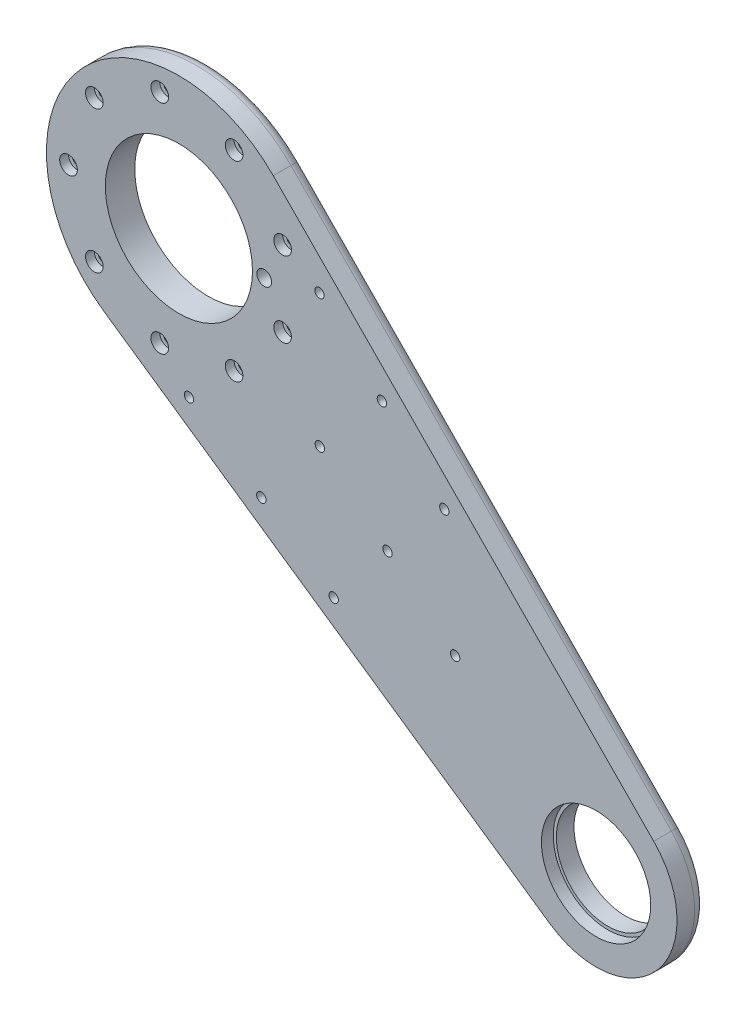
from build123d import *

# Parameters (mm, degrees)
SKETCH1_R           = 17.5
SKETCH1_R_2         = 1.6
BOSS_EXTRUDE1_DEPTH = 10
SKETCH2_R           = 25
SKETCH2_R_2         = 2.5
SKETCH2_R_3         = 1.6
CUT_EXTRUDE1_DEPTH  = 224.991888552
SKETCH3_R           = 18.5625
CUT_EXTRUDE2_DEPTH  = 4
SKETCH4_R           = 3
CUT_EXTRUDE3_DEPTH  = 3
FILLET1_R           = 4


with BuildPart() as part:
    # Sketch1 → Boss-Extrude1 (new body)
    with BuildSketch(Plane.XY):
        with BuildLine():
            Line((-25.534872354, -37.053613776), (126.113577761, -141.559582877))
            ThreePointArc((126.113577761, -141.559582877), (162.784444163, -136.592367058), (161.308367688, -99.616065541))
            Line((161.308367688, -99.616065541), (32.056602073, 31.581232775))
            ThreePointArc((32.056602073, 31.581232775), (-34.47199994, 28.925442436), (-25.534872354, -37.053613776))
        make_face()
        with Locations((141.718221977, -118.915707792)):
            Circle(SKETCH1_R, mode=Mode.SUBTRACT)
        with Locations((70.859110989, -59.457853896)):
            Circle(SKETCH1_R_2, mode=Mode.SUBTRACT)
        with Locations((93.840444282, -78.741482187)):
            Circle(SKETCH1_R_2, mode=Mode.SUBTRACT)
        with Locations((47.877777695, -40.174225605)):
            Circle(SKETCH1_R_2, mode=Mode.SUBTRACT)
        with Locations((47.767990244, 4.946625931)):
            Circle(SKETCH1_R_2, mode=Mode.SUBTRACT)
        with Locations((3.423348889, -47.901259716)):
            Circle(SKETCH1_R_2, mode=Mode.SUBTRACT)
        with Locations((68.973861607, -16.273907044)):
            Circle(SKETCH1_R_2, mode=Mode.SUBTRACT)
        with Locations((90.17973297, -37.494440018)):
            Circle(SKETCH1_R_2, mode=Mode.SUBTRACT)
        with Locations((28.003855203, -65.100059364)):
            Circle(SKETCH1_R_2, mode=Mode.SUBTRACT)
        with Locations((52.584361518, -82.298859012)):
            Circle(SKETCH1_R_2, mode=Mode.SUBTRACT)
    extrude(amount=BOSS_EXTRUDE1_DEPTH)

    # Sketch2 → Cut-Extrude1 (cut, through all)
    with BuildSketch(Plane.XY.offset(10)):
        Circle(SKETCH2_R)
        with Locations((29, 0)):
            Circle(SKETCH2_R_2)
        with Locations((-37.5, 0)):
            Circle(SKETCH2_R_3)
        with Locations((-28.726666617, 24.104535363)):
            Circle(SKETCH2_R_3)
        with Locations((-6.511806663, 36.930290738)):
            Circle(SKETCH2_R_3)
        with Locations((18.75, 32.475952642)):
            Circle(SKETCH2_R_3)
        with Locations((35.238473279, 12.825755375)):
            Circle(SKETCH2_R_3)
        with Locations((35.238473279, -12.825755375)):
            Circle(SKETCH2_R_3)
        with Locations((18.75, -32.475952642)):
            Circle(SKETCH2_R_3)
        with Locations((-6.511806663, -36.930290738)):
            Circle(SKETCH2_R_3)
        with Locations((-28.726666617, -24.104535363)):
            Circle(SKETCH2_R_3)
    extrude(amount=-CUT_EXTRUDE1_DEPTH, mode=Mode.SUBTRACT)

    # Sketch3 → Cut-Extrude2 (cut)
    with BuildSketch(Plane.XY.offset(10)):
        with Locations((141.718221977, -118.915707792)):
            Circle(SKETCH3_R)
    extrude(amount=-CUT_EXTRUDE2_DEPTH, mode=Mode.SUBTRACT)

    # Sketch4 → Cut-Extrude3 (cut)
    with BuildSketch(Plane.XY.offset(10)):
        with Locations((-28.726666617, 24.104535363)):
            Circle(SKETCH4_R)
        with Locations((-6.511806663, 36.930290738)):
            Circle(SKETCH4_R)
        with Locations((18.75, 32.475952642)):
            Circle(SKETCH4_R)
        with Locations((35.238473279, 12.825755375)):
            Circle(SKETCH4_R)
        with Locations((35.238473279, -12.825755375)):
            Circle(SKETCH4_R)
        with Locations((18.75, -32.475952642)):
            Circle(SKETCH4_R)
        with Locations((-6.511806663, -36.930290738)):
            Circle(SKETCH4_R)
        with Locations((-28.726666617, -24.104535363)):
            Circle(SKETCH4_R)
        with Locations((-37.5, 0)):
            Circle(SKETCH4_R)
    extrude(amount=-CUT_EXTRUDE3_DEPTH, mode=Mode.SUBTRACT)

    # Fillet1
    fillet1_edges = [part.edges().sort_by_distance(p)[0] for p in [
        (96.68248488, -34.017416383, 0),
        (162.784444163, -136.592367058, 0),
        (50.289352703, -89.306598327, 0),
        (-34.47199994, 28.925442436, 0),
    ]]
    fillet(fillet1_edges, radius=FILLET1_R)


solid = part.part
